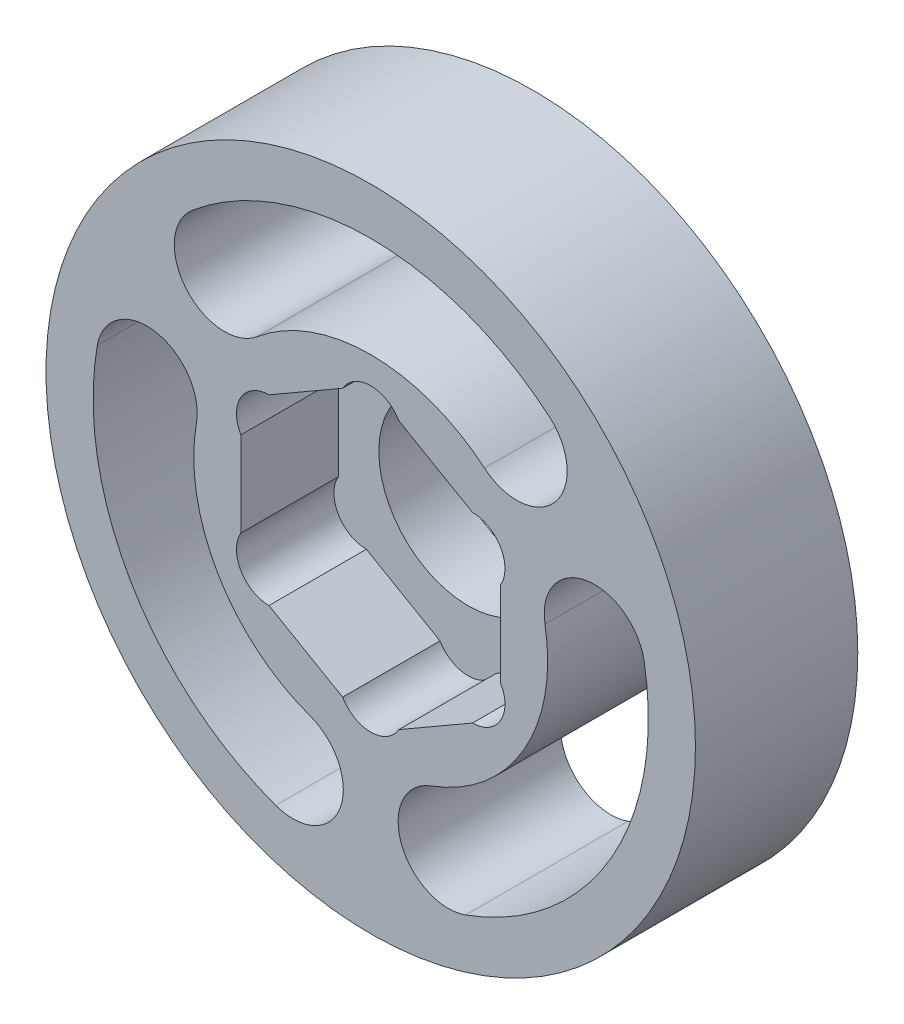
from build123d import *

# Parameters (mm, degrees)
SKETCH_1_R          = 10
EXTRUDE_1_DEPTH     = 5
CUT_EXTRUDE_1_DEPTH = 3
SKETCH_4_R          = 1
CUT_EXTRUDE_3_DEPTH = 3
CUT_EXTRUDE_2_DEPTH = 5
SKETCH_5_R          = 2.75
CUT_EXTRUDE_4_DEPTH = 10


with BuildPart() as part:
    # 스케치1 → 보스-돌출1 (new body)
    with BuildSketch(Plane.XY):
        Circle(SKETCH_1_R)
    extrude(amount=EXTRUDE_1_DEPTH)

    # 스케치2 → 컷-돌출1 (cut)
    with BuildSketch(Plane.XY.offset(5)):
        Polygon((0, 4.618802154), (-4, 2.309401077), (-4, -2.309401077), (0, -4.618802154), (4, -2.309401077), (4, 2.309401077), align=None)
    extrude(amount=-CUT_EXTRUDE_1_DEPTH, mode=Mode.SUBTRACT)

    # 스케치4 → 컷-돌출3 (cut)
    with BuildSketch(Plane.XY.offset(5)):
        with Locations((0, 3.618802154)):
            Circle(SKETCH_4_R)
        with Locations((3.133974596, 1.809401077)):
            Circle(SKETCH_4_R)
        with Locations((3.133974596, -1.809401077)):
            Circle(SKETCH_4_R)
        with Locations((0, -3.618802154)):
            Circle(SKETCH_4_R)
        with Locations((-3.133974596, -1.809401077)):
            Circle(SKETCH_4_R)
        with Locations((-3.133974596, 1.809401077)):
            Circle(SKETCH_4_R)
    extrude(amount=-CUT_EXTRUDE_3_DEPTH, mode=Mode.SUBTRACT)

    # 스케치3 → 컷-돌출2 (cut)
    with BuildSketch(Plane.XY.offset(5)):
        with BuildLine():
            ThreePointArc((5.495834063, 6.549679989), (0, 8.55), (-5.495834063, 6.549679989))
            ThreePointArc((-5.495834063, 6.549679989), (-5.686882155, 4.365990307), (-3.503192473, 4.174942215))
            ThreePointArc((-3.503192473, 4.174942215), (0, 5.45), (3.503192473, 4.174942215))
            ThreePointArc((3.503192473, 4.174942215), (5.686882155, 4.365990307), (5.495834063, 6.549679989))
        make_face()
        with BuildLine():
            ThreePointArc((2.924272225, -8.034371908), (7.404517202, -4.275), (8.420106288, 1.484691919))
            ThreePointArc((8.420106288, 1.484691919), (6.624499596, 2.741989261), (5.367202254, 0.946382568))
            ThreePointArc((5.367202254, 0.946382568), (4.719838451, -2.725), (1.864009781, -5.121324783))
            ThreePointArc((1.864009781, -5.121324783), (0.937617441, -7.107979568), (2.924272225, -8.034371908))
        make_face()
        with BuildLine():
            ThreePointArc((-8.420106288, 1.484691919), (-7.404517202, -4.275), (-2.924272225, -8.034371908))
            ThreePointArc((-2.924272225, -8.034371908), (-0.937617441, -7.107979568), (-1.864009781, -5.121324783))
            ThreePointArc((-1.864009781, -5.121324783), (-4.719838451, -2.725), (-5.367202254, 0.946382568))
            ThreePointArc((-5.367202254, 0.946382568), (-6.624499596, 2.741989261), (-8.420106288, 1.484691919))
        make_face()
    extrude(amount=-CUT_EXTRUDE_2_DEPTH, mode=Mode.SUBTRACT)

    # 스케치5 → 컷-돌출4 (cut)
    with BuildSketch(Plane(origin=(0, 0, 0), x_dir=(-1, 0, 0), z_dir=(0, 0, -1))):
        Circle(SKETCH_5_R)
    extrude(amount=-CUT_EXTRUDE_4_DEPTH, mode=Mode.SUBTRACT)


solid = part.part
